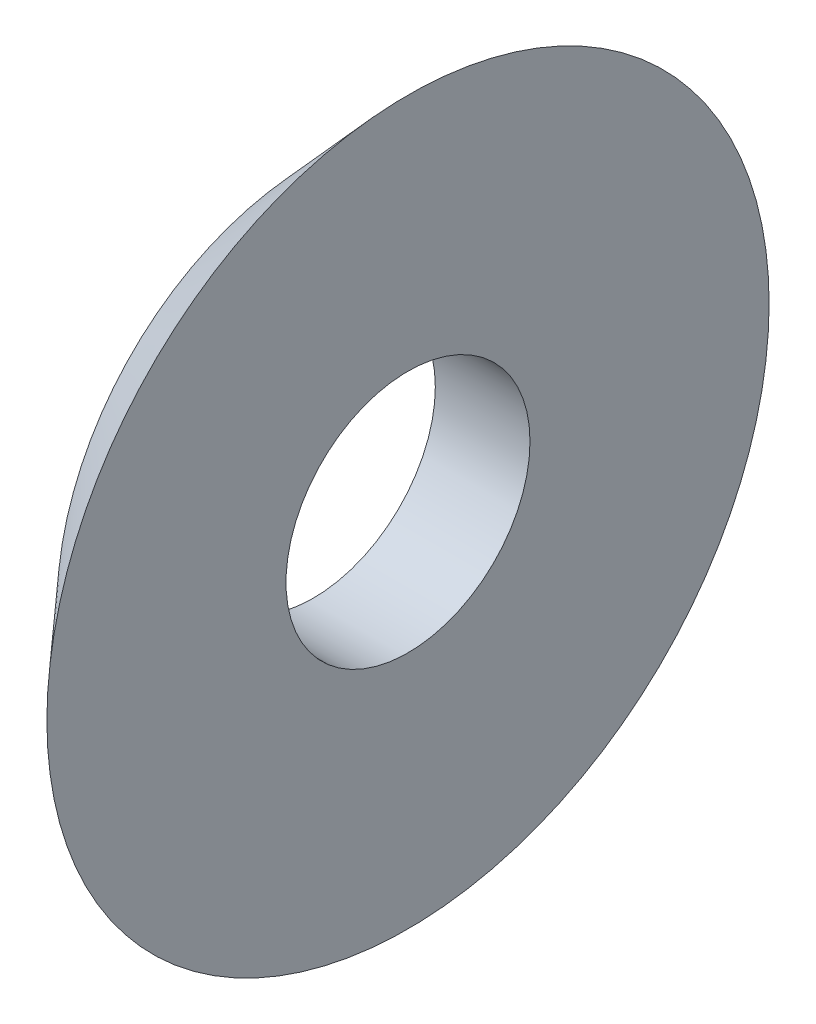
from build123d import *


with BuildPart() as part:
    # Sketch2 → Revolve1 (revolve)
    with BuildSketch(Plane.XY, mode=Mode.PRIVATE) as revolve1_sk:
        Polygon((-1.94, 2.5), (-1.94, 5.25), (0, 7.4), (0, 2.5), align=None)
    revolve(revolve1_sk.sketch.rotate(Axis((0, 0, 0), (-1, 0, 0)), 90), axis=Axis((0, 0, 0), (-1, 0, 0)))


solid = part.part
